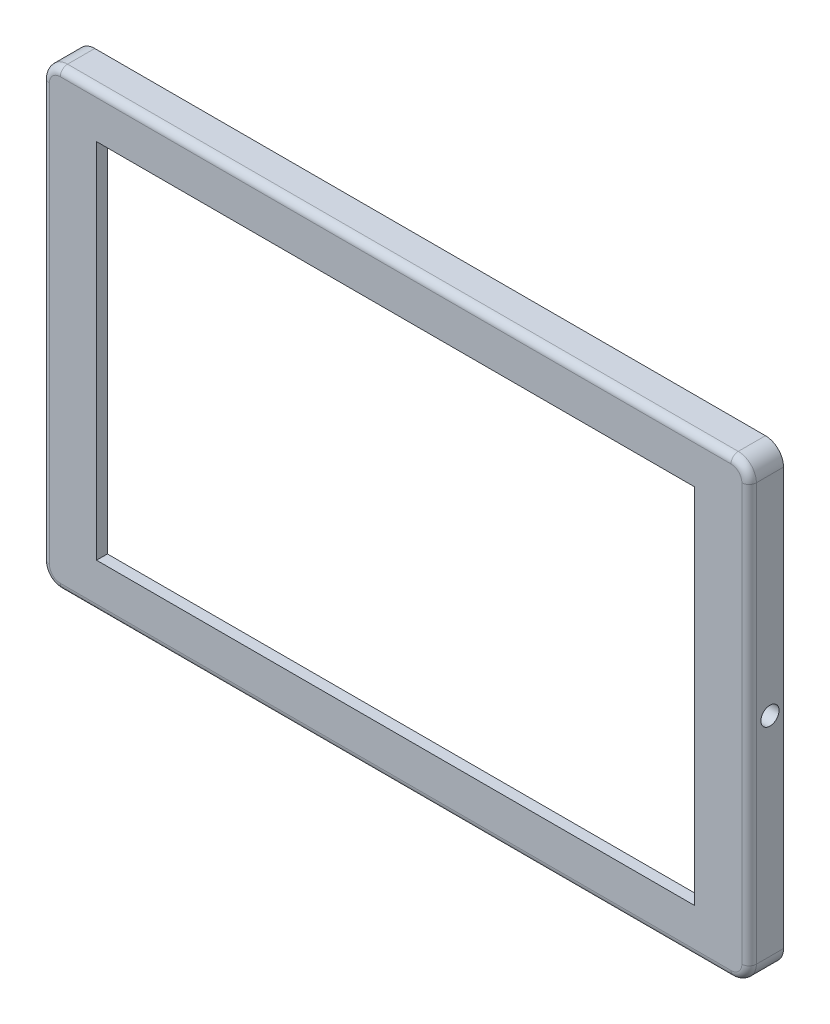
from build123d import *

# Parameters (mm, degrees)
SKETCH2_W           = 195
SKETCH2_H           = 125
SKETCH2_W_2         = 185
SKETCH2_H_2         = 115
BOSS_EXTRUDE1_DEPTH = 9.5
SKETCH3_W           = 195
SKETCH3_H           = 125
SKETCH3_W_2         = 165
SKETCH3_H_2         = 100
BOSS_EXTRUDE2_DEPTH = 3
FILLET1_R           = 5
FILLET2_R           = 2
SKETCH4_R           = 2.5
CUT_EXTRUDE1_DEPTH  = 205.991463237


with BuildPart() as part:
    # Sketch2 → Boss-Extrude1 (new body)
    with BuildSketch(Plane.XY):
        Rectangle(SKETCH2_W, SKETCH2_H)
        Rectangle(SKETCH2_W_2, SKETCH2_H_2, mode=Mode.SUBTRACT)
    extrude(amount=BOSS_EXTRUDE1_DEPTH)

    # Sketch3 → Boss-Extrude2 (add)
    with BuildSketch(Plane.XY.offset(9.5)):
        Rectangle(SKETCH3_W, SKETCH3_H)
        Rectangle(SKETCH3_W_2, SKETCH3_H_2, mode=Mode.SUBTRACT)
    extrude(amount=-BOSS_EXTRUDE2_DEPTH)

    # Fillet1
    fillet1_edges = [part.edges().sort_by_distance(p)[0] for p in [
        (-97.5, 62.5, 4.75),
        (97.5, 62.5, 4.75),
        (97.5, -62.5, 4.75),
        (-97.5, -62.5, 4.75),
    ]]
    fillet(fillet1_edges, radius=FILLET1_R)

    # Fillet2
    fillet2_edges = [part.edges().sort_by_distance(p)[0] for p in [
        (0, 62.5, 9.5),
        (-96.035533906, 61.035533906, 9.5),
        (96.035533906, 61.035533906, 9.5),
        (-97.5, 0, 9.5),
        (97.5, 0, 9.5),
        (-96.035533906, -61.035533906, 9.5),
        (96.035533906, -61.035533906, 9.5),
        (0, -62.5, 9.5),
    ]]
    fillet(fillet2_edges, radius=FILLET2_R)

    # Sketch4 → Cut-Extrude1 (cut, through all)
    with BuildSketch(Plane.ZY.offset(97.5)):
        with Locations(Location((3.75, 0, 0), (0, 0, 270))):
            Circle(SKETCH4_R)
    extrude(amount=-CUT_EXTRUDE1_DEPTH, mode=Mode.SUBTRACT)


solid = part.part
